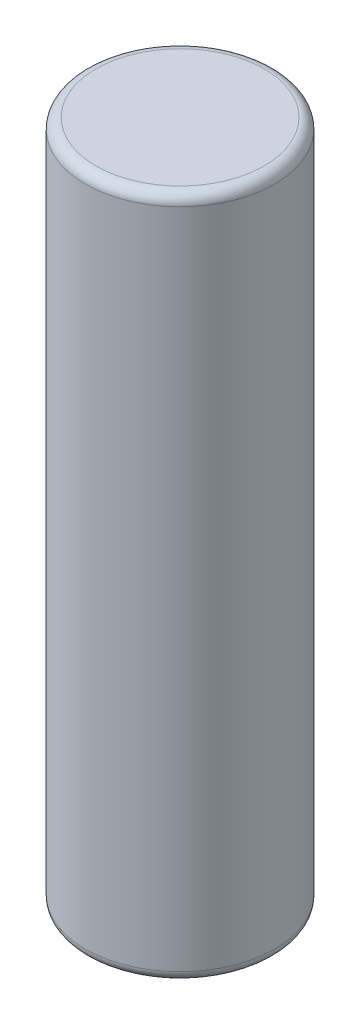
from build123d import *

# Parameters (mm, degrees)
BOSS_EXTRUDE1_DEPTH      = 50
BOSS_EXTRUDE1_DEPTH_BACK = 600
SKETCH1_R                = 90
FILLET1_R                = 10


with BuildPart() as part:
    # Sketch1 → Boss-Extrude1 (new, two sides: drawn at the far end of the back side and taken through both)
    with BuildSketch(Plane(origin=(0, 871.709797624, 0), x_dir=(1, 0, 0), z_dir=(0, 1, 0)).offset(-BOSS_EXTRUDE1_DEPTH_BACK)):
        with Locations(Location((366.998911685, 847.87453746, 0), (0, 0, 270))):
            Circle(SKETCH1_R)
    extrude(amount=BOSS_EXTRUDE1_DEPTH + BOSS_EXTRUDE1_DEPTH_BACK)

    # Fillet1
    fillet1_edges = [part.edges().sort_by_distance(p)[0] for p in [
        (366.998911685, 271.709797624, -937.87453746),
        (366.998911685, 921.709797624, -937.87453746),
    ]]
    fillet(fillet1_edges, radius=FILLET1_R)


solid = part.part
